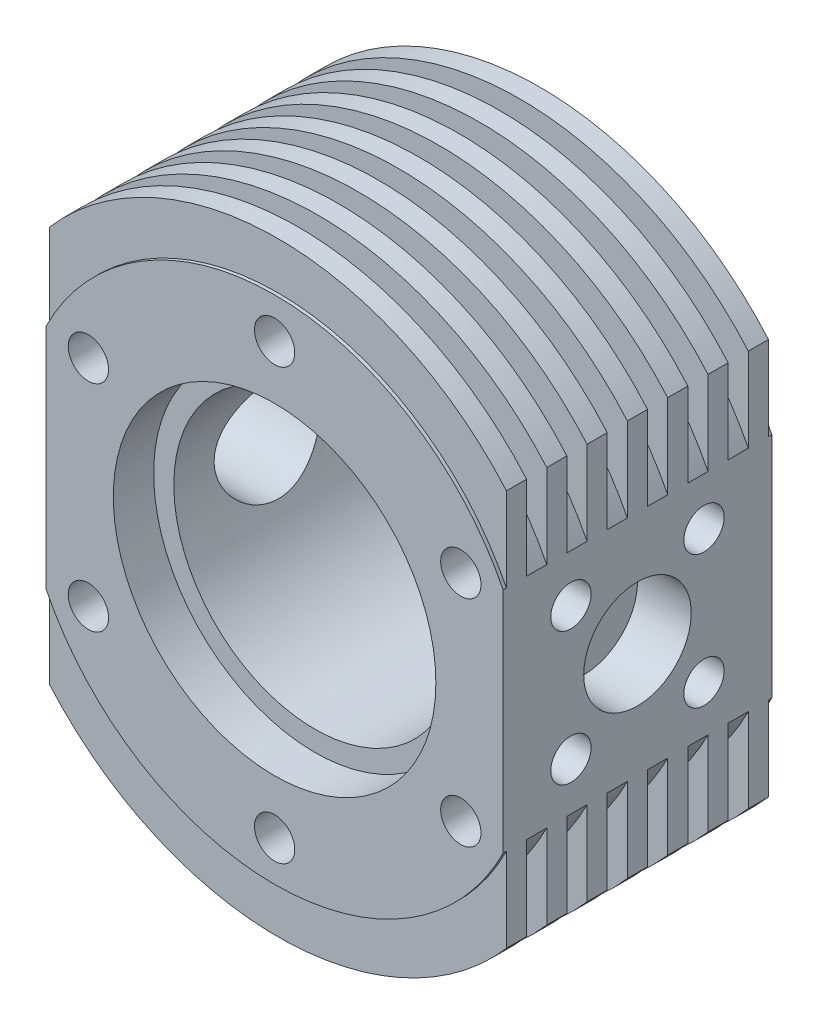
from build123d import *

# Parameters (mm, degrees)
SKETCH1_R               = 10.5
BOSS_EXTRUDE1_DEPTH     = 20
SKETCH2_R               = 12
CUT_EXTRUDE1_DEPTH      = 3
CUT_EXTRUDE2_DEPTH      = 0.25
CUT_EXTRUDE3_START      = -0.25
CUT_EXTRUDE3_DEPTH      = 0.25
CUT_EXTRUDE4_START      = -1.5
CUT_EXTRUDE4_DEPTH      = 1.5
LPATTERN1_COUNT         = 6
LPATTERN1_PITCH         = 3
MIRROR1_START           = -1.5
MIRROR1_COPY_1_DEPTH    = 1.5
MIRROR1_COPY_2_DEPTH    = 1.5
MIRROR1_COPY_3_DEPTH    = 1.5
MIRROR1_COPY_4_DEPTH    = 1.5
MIRROR1_COPY_5_DEPTH    = 1.5
CUT_EXTRUDE5_REACH      = 47.412
CUT_EXTRUDE5_END_RADIUS = 10.5
SKETCH6_R               = 4
SKETCH8_R               = 4
SKETCH8_R_2             = 1.5
CUT_EXTRUDE6_DEPTH      = 4
SKETCH10_R              = 1.5
CUT_EXTRUDE7_DEPTH      = 6


with BuildPart() as part:
    # Sketch1 → Boss-Extrude1 (new body)
    with BuildSketch(Plane.XY):
        with BuildLine():
            Line((-17, -14.739402973), (-17, 14.739402973))
            ThreePointArc((-17, 14.739402973), (0, 22.5), (17, 14.739402973))
            Line((17, 14.739402973), (17, -14.739402973))
            ThreePointArc((17, -14.739402973), (0, -22.5), (-17, -14.739402973))
        make_face()
        Circle(SKETCH1_R, mode=Mode.SUBTRACT)
    extrude(amount=BOSS_EXTRUDE1_DEPTH)

    # Sketch2 → Cut-Extrude1 (cut)
    with BuildSketch(Plane.XY.offset(20)):
        Circle(SKETCH2_R)
    extrude(amount=-CUT_EXTRUDE1_DEPTH, mode=Mode.SUBTRACT)

    # Sketch3 → Cut-Extrude2 (cut)
    with BuildSketch(Plane(origin=(0, 0, 0), x_dir=(-1, 0, 0), z_dir=(0, 0, -1))):
        with BuildLine():
            ThreePointArc((-17, 8.485281374), (0, 19), (17, 8.485281374))
            Line((17, 8.485281374), (17, 14.739402973))
            ThreePointArc((17, 14.739402973), (0, 22.5), (-17, 14.739402973))
            Line((-17, 14.739402973), (-17, 8.485281374))
        make_face()
        with BuildLine():
            Line((17, -14.739402973), (17, -8.485281374))
            ThreePointArc((17, -8.485281374), (0, -19), (-17, -8.485281374))
            Line((-17, -8.485281374), (-17, -14.739402973))
            ThreePointArc((-17, -14.739402973), (0, -22.5), (17, -14.739402973))
        make_face()
    extrude(amount=-CUT_EXTRUDE2_DEPTH, mode=Mode.SUBTRACT)

    # Sketch4 → Cut-Extrude3 (cut)
    with BuildSketch(Plane.XY.offset(20).offset(CUT_EXTRUDE3_START)):
        with BuildLine():
            ThreePointArc((-17, 8.485281374), (0, 19), (17, 8.485281374))
            Line((17, 8.485281374), (17, 14.739402973))
            ThreePointArc((17, 14.739402973), (0, 22.5), (-17, 14.739402973))
            Line((-17, 14.739402973), (-17, 8.485281374))
        make_face()
        with BuildLine():
            Line((17, -14.739402973), (17, -8.485281374))
            ThreePointArc((17, -8.485281374), (0, -19), (-17, -8.485281374))
            Line((-17, -8.485281374), (-17, -14.739402973))
            ThreePointArc((-17, -14.739402973), (0, -22.5), (17, -14.739402973))
        make_face()
    extrude(amount=CUT_EXTRUDE3_DEPTH, mode=Mode.SUBTRACT)

    # Sketch5 → Cut-Extrude4 (cut)
    with BuildSketch(Plane.XY.offset(18.25).offset(CUT_EXTRUDE4_START)):
        with BuildLine():
            Line((17, 8.485281374), (17, 14.739402973))
            ThreePointArc((17, 14.739402973), (0, 22.5), (-17, 14.739402973))
            Line((-17, 14.739402973), (-17, 8.485281374))
            ThreePointArc((-17, 8.485281374), (0, 19), (17, 8.485281374))
        make_face()
    cut_extrude4 = extrude(amount=CUT_EXTRUDE4_DEPTH, mode=Mode.SUBTRACT)

    # LPattern1: Cut-Extrude4 ×6
    with Locations(*[(0, 0, -i * LPATTERN1_PITCH) for i in range(1, LPATTERN1_COUNT)]):
        add(cut_extrude4, mode=Mode.SUBTRACT)

    # Mirror1: Cut-Extrude4 across plane
    add(cut_extrude4.mirror(Plane.ZX), mode=Mode.SUBTRACT)

    # Mirror1 copy 1 sketch → Mirror1 copy 1 (cut)
    with BuildSketch(Plane.XY.offset(15.25).offset(MIRROR1_START)):
        with BuildLine():
            Line((17, -8.485281374), (17, -14.739402973))
            ThreePointArc((17, -14.739402973), (0, -22.5), (-17, -14.739402973))
            Line((-17, -14.739402973), (-17, -8.485281374))
            ThreePointArc((-17, -8.485281374), (0, -19), (17, -8.485281374))
        make_face()
    extrude(amount=MIRROR1_COPY_1_DEPTH, mode=Mode.SUBTRACT)

    # Mirror1 copy 2 sketch → Mirror1 copy 2 (cut)
    with BuildSketch(Plane.XY.offset(12.25).offset(MIRROR1_START)):
        with BuildLine():
            Line((17, -8.485281374), (17, -14.739402973))
            ThreePointArc((17, -14.739402973), (0, -22.5), (-17, -14.739402973))
            Line((-17, -14.739402973), (-17, -8.485281374))
            ThreePointArc((-17, -8.485281374), (0, -19), (17, -8.485281374))
        make_face()
    extrude(amount=MIRROR1_COPY_2_DEPTH, mode=Mode.SUBTRACT)

    # Mirror1 copy 3 sketch → Mirror1 copy 3 (cut)
    with BuildSketch(Plane.XY.offset(9.25).offset(MIRROR1_START)):
        with BuildLine():
            Line((17, -8.485281374), (17, -14.739402973))
            ThreePointArc((17, -14.739402973), (0, -22.5), (-17, -14.739402973))
            Line((-17, -14.739402973), (-17, -8.485281374))
            ThreePointArc((-17, -8.485281374), (0, -19), (17, -8.485281374))
        make_face()
    extrude(amount=MIRROR1_COPY_3_DEPTH, mode=Mode.SUBTRACT)

    # Mirror1 copy 4 sketch → Mirror1 copy 4 (cut)
    with BuildSketch(Plane.XY.offset(6.25).offset(MIRROR1_START)):
        with BuildLine():
            Line((17, -8.485281374), (17, -14.739402973))
            ThreePointArc((17, -14.739402973), (0, -22.5), (-17, -14.739402973))
            Line((-17, -14.739402973), (-17, -8.485281374))
            ThreePointArc((-17, -8.485281374), (0, -19), (17, -8.485281374))
        make_face()
    extrude(amount=MIRROR1_COPY_4_DEPTH, mode=Mode.SUBTRACT)

    # Mirror1 copy 5 sketch → Mirror1 copy 5 (cut)
    with BuildSketch(Plane.XY.offset(3.25).offset(MIRROR1_START)):
        with BuildLine():
            Line((17, -8.485281374), (17, -14.739402973))
            ThreePointArc((17, -14.739402973), (0, -22.5), (-17, -14.739402973))
            Line((-17, -14.739402973), (-17, -8.485281374))
            ThreePointArc((-17, -8.485281374), (0, -19), (17, -8.485281374))
        make_face()
    extrude(amount=MIRROR1_COPY_5_DEPTH, mode=Mode.SUBTRACT)

    # Cut-Extrude5: up to this cylinder (the profile starts outside it)
    cut_extrude5_end = Plane(origin=(0, 0, 10), z_dir=(0, 0, -1)) * Cylinder(CUT_EXTRUDE5_END_RADIUS, 116.824, mode=Mode.PRIVATE)
    # Sketch6 → Cut-Extrude5 (cut, up to the surface)
    with BuildSketch(Plane.ZY.offset(17), mode=Mode.PRIVATE) as cut_extrude5_sk1:
        with Locations((10, 0)):
            Circle(SKETCH6_R)
    cut_extrude5_tool1 = extrude(cut_extrude5_sk1.sketch, amount=-CUT_EXTRUDE5_REACH, mode=Mode.PRIVATE) - cut_extrude5_end
    add(cut_extrude5_tool1.solids().sort_by_distance((-17, 0, 10))[0], mode=Mode.SUBTRACT)

    # Sketch8 → Cut-Extrude6 (cut)
    with BuildSketch(Plane.ZY.offset(17)):
        with Locations((10, 0)):
            Circle(SKETCH8_R)
        with Locations((5.050252532, 4.949747468)):
            Circle(SKETCH8_R_2)
        with Locations((14.949747468, 4.949747468)):
            Circle(SKETCH8_R_2)
        with Locations((14.949747468, -4.949747468)):
            Circle(SKETCH8_R_2)
        with Locations((5.050252532, -4.949747468)):
            Circle(SKETCH8_R_2)
    cut_extrude6 = extrude(amount=-CUT_EXTRUDE6_DEPTH, mode=Mode.SUBTRACT)

    # Sketch9 → Cut-Revolve1 (revolve, cut)
    with BuildSketch(Plane(origin=(0, 0, 10), x_dir=(-1, 0, 0), z_dir=(0, 0, -1)), mode=Mode.PRIVATE) as cut_revolve1_sk:
        Polygon((-17, 0), (-11.5, 0), (-14.5, -3), (-17, -3), align=None)
    revolve(cut_revolve1_sk.sketch.rotate(Axis((17, 0, 10), (-1, 0, 0)), 270), axis=Axis((17, 0, 10), (-1, 0, 0)), mode=Mode.SUBTRACT)

    # Mirror2: Cut-Extrude6 across plane
    add(cut_extrude6.mirror(Plane(origin=(0, 0, 0), x_dir=(0, 0, 1), z_dir=(1, 0, 0))), mode=Mode.SUBTRACT)

    # Sketch10 → Cut-Extrude7 (cut)
    with BuildSketch(Plane(origin=(0, 0, 0), x_dir=(-1, 0, 0), z_dir=(0, 0, -1))):
        with Locations((0, 16)):
            Circle(SKETCH10_R)
        with Locations((13.856406461, 8)):
            Circle(SKETCH10_R)
        with Locations((13.856406461, -8)):
            Circle(SKETCH10_R)
        with Locations((0, -16)):
            Circle(SKETCH10_R)
        with Locations((-13.856406461, -8)):
            Circle(SKETCH10_R)
        with Locations((-13.856406461, 8)):
            Circle(SKETCH10_R)
    cut_extrude7 = extrude(amount=-CUT_EXTRUDE7_DEPTH, mode=Mode.SUBTRACT)

    # Mirror3: Cut-Extrude7 across plane
    add(cut_extrude7.mirror(Plane(origin=(0, 0, 10), x_dir=(1, 0, 0), z_dir=(0, 0, -1))), mode=Mode.SUBTRACT)


solid = part.part
